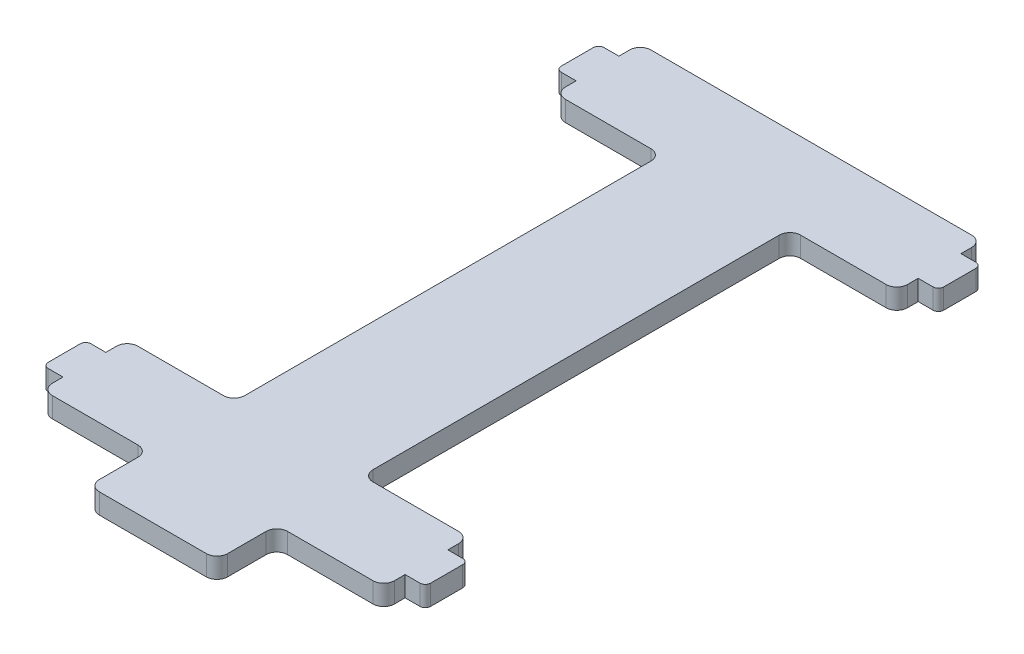
from build123d import *

# Parameters (mm, degrees)
BOSS_EXTRUDE1_DEPTH = 1.5
FILLET1_R           = 1.5875
SKETCH2_W           = 3
SKETCH2_H           = 6.35
BOSS_EXTRUDE2_DEPTH = 3
FILLET2_R           = 0.79375


with BuildPart() as part:
    # Sketch1 → Boss-Extrude1 (new, symmetric)
    with BuildSketch(Plane(origin=(0, 0, 0), x_dir=(1, 0, 0), z_dir=(0, 1, 0))):
        Polygon((25.4, 31.75), (9.525, 31.75), (9.525, -31.75), (25.4, -31.75), (25.4, -44.45), (9.525, -44.45), (9.525, -53.34), (-9.525, -53.34), (-9.525, -44.45), (-25.4, -44.45), (-25.4, -31.75), (-9.525, -31.75), (-9.525, 31.75), (-25.4, 31.75), (-25.4, 44.45), (25.4, 44.45), align=None)
    extrude(amount=BOSS_EXTRUDE1_DEPTH, both=True)

    # Fillet1
    fillet1_edges = [part.edges().sort_by_distance(p)[0] for p in [
        (25.4, 0, -44.45),
        (25.4, 0, -31.75),
        (9.525, 0, -31.75),
        (9.525, 0, 31.75),
        (25.4, 0, 31.75),
        (25.4, 0, 44.45),
        (9.525, 0, 44.45),
        (9.525, 0, 53.34),
        (-9.525, 0, 53.34),
        (-9.525, 0, 44.45),
        (-25.4, 0, 44.45),
        (-25.4, 0, 31.75),
        (-9.525, 0, 31.75),
        (-9.525, 0, -31.75),
        (-25.4, 0, -31.75),
        (-25.4, 0, -44.45),
    ]]
    fillet(fillet1_edges, radius=FILLET1_R)

    # Sketch2 → Boss-Extrude2 (add)
    with BuildSketch(Plane(origin=(0, 1.5, 0), x_dir=(1, 0, 0), z_dir=(0, 1, 0))):
        with Locations((-26.9, 38.1)):
            Rectangle(SKETCH2_W, SKETCH2_H)
        with Locations((26.9, 38.1)):
            Rectangle(SKETCH2_W, SKETCH2_H)
        with Locations((26.9, -38.1)):
            Rectangle(SKETCH2_W, SKETCH2_H)
        with Locations((-26.9, -38.1)):
            Rectangle(SKETCH2_W, SKETCH2_H)
    extrude(amount=-BOSS_EXTRUDE2_DEPTH)

    # Fillet2
    fillet2_edges = [part.edges().sort_by_distance(p)[0] for p in [
        (-28.4, 0, 41.275),
        (-28.4, 0, 34.925),
        (28.4, 0, 34.925),
        (28.4, 0, 41.275),
        (28.4, 0, -41.275),
        (28.4, 0, -34.925),
        (-28.4, 0, -34.925),
        (-28.4, 0, -41.275),
    ]]
    fillet(fillet2_edges, radius=FILLET2_R)


solid = part.part
